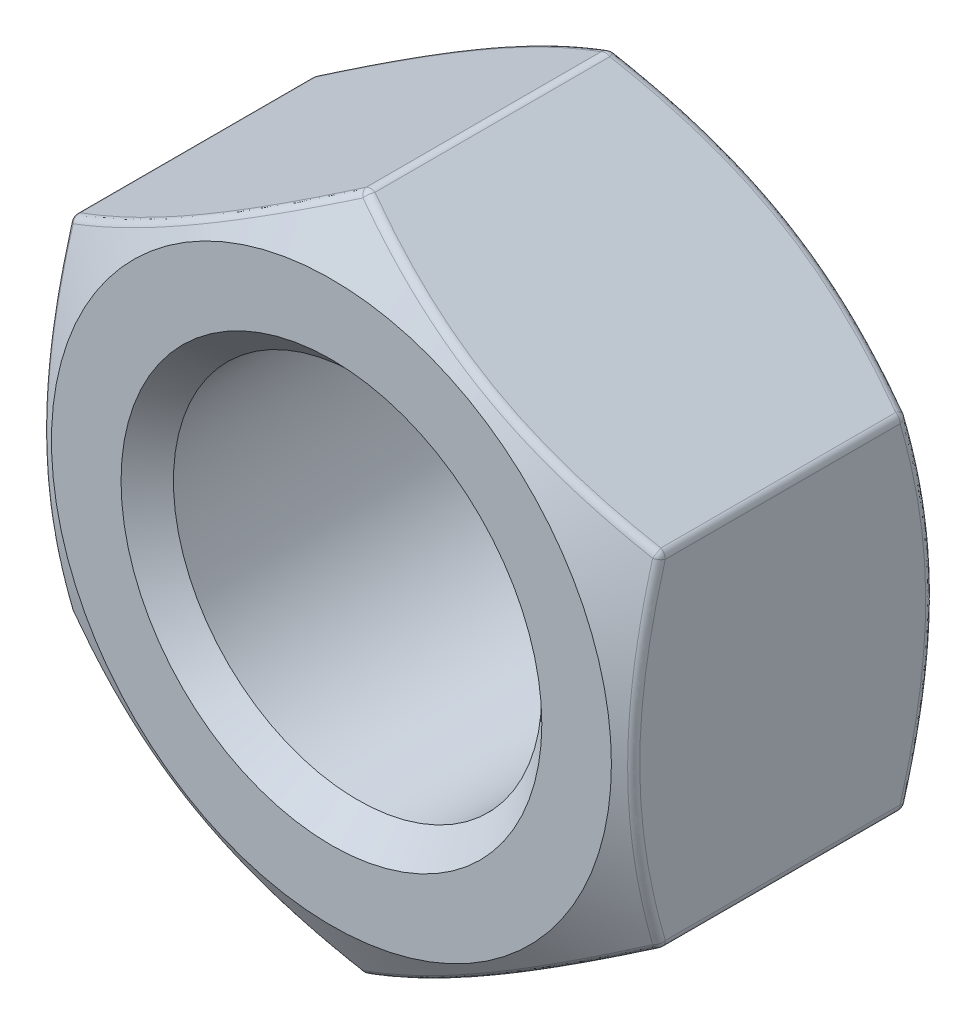
from build123d import *

# Parameters (mm, degrees)
SKETCH3_R           = 3.96875
BOSS_EXTRUDE1_DEPTH = 3.3734375
SKETCH4_OUTSIDE_W   = 63.202
SKETCH4_OUTSIDE_H   = 65.166
SKETCH4_OUTSIDE_R   = 6.0325
CUT_EXTRUDE1_DEPTH  = 12.815504881
CUT_EXTRUDE1_DRAFT  = -60
CUT_EXTRUDE2_START  = -6.746875
SKETCH4_2_OUTSIDE_W = 86.574
SKETCH4_2_OUTSIDE_H = 88.538
SKETCH4_2_OUTSIDE_R = 6.0325
CUT_EXTRUDE2_DEPTH  = 19.562379881
CUT_EXTRUDE2_DRAFT  = 60
FILLET1_R           = 0.1905
CHAMFER1_SIZE       = 0.564444444


with BuildPart() as part:
    # Sketch3 → Boss-Extrude1 (new, symmetric)
    with BuildSketch(Plane.XY):
        Polygon((0, 7.332348419), (-6.35, 3.666174209), (-6.35, -3.666174209), (0, -7.332348419), (6.35, -3.666174209), (6.35, 3.666174209), align=None)
        Circle(SKETCH3_R, mode=Mode.SUBTRACT)
    extrude(amount=BOSS_EXTRUDE1_DEPTH, both=True)


with BuildPart() as cut_extrude1_tool:
    # Sketch4 outside → Cut-Extrude1 (with draft: the straight prism first)
    with BuildSketch(Plane.XY.offset(3.3734375)):
        Rectangle(SKETCH4_OUTSIDE_W, SKETCH4_OUTSIDE_H)
        Circle(SKETCH4_OUTSIDE_R, mode=Mode.SUBTRACT)
    extrude(amount=-CUT_EXTRUDE1_DEPTH)
    # Cut-Extrude1: the draft: its side faces are tilted about the plane it starts from
    cut_extrude1_sides = [cut_extrude1_tool.faces().sort_by_distance(p)[0] for p in [
        (0, -32.583, -3.034314941),
        (31.601, 0, -3.034314941),
        (0, 32.583, -3.034314941),
        (-31.601, 0, -3.034314941),
        (-6.0325, 0, -3.034314941),
    ]]
    draft(cut_extrude1_sides, Plane.XY.offset(3.3734375), CUT_EXTRUDE1_DRAFT)


with BuildPart() as part_1:
    add(part.part)

    # Cut-Extrude1: cut by cut_extrude1_tool
    add(cut_extrude1_tool.part, mode=Mode.SUBTRACT)


with BuildPart() as cut_extrude2_tool:
    # Sketch4<2> outside → Cut-Extrude2 (with draft: the straight prism first)
    with BuildSketch(Plane.XY.offset(3.3734375).offset(CUT_EXTRUDE2_START)):
        Rectangle(SKETCH4_2_OUTSIDE_W, SKETCH4_2_OUTSIDE_H)
        Circle(SKETCH4_2_OUTSIDE_R, mode=Mode.SUBTRACT)
    extrude(amount=CUT_EXTRUDE2_DEPTH)
    # Cut-Extrude2: the draft: its side faces are tilted about the plane it starts from
    cut_extrude2_sides = [cut_extrude2_tool.faces().sort_by_distance(p)[0] for p in [
        (0, -44.269, 6.407752441),
        (43.287, 0, 6.407752441),
        (0, 44.269, 6.407752441),
        (-43.287, 0, 6.407752441),
        (-6.0325, 0, 6.407752441),
    ]]
    draft(cut_extrude2_sides, Plane.XY.offset(3.3734375).offset(CUT_EXTRUDE2_START), CUT_EXTRUDE2_DRAFT)


with BuildPart() as part_2:
    add(part_1.part)

    # Cut-Extrude2: cut by cut_extrude2_tool
    add(cut_extrude2_tool.part, mode=Mode.SUBTRACT)

    # Fillet1
    fillet1_edges = [part_2.edges().sort_by_distance(p)[0] for p in [
        (6.35, 3.666174209, 0),
        (6.35, -3.666174209, 0),
        (6.35, -1.852859506, 3.037246032),
        (0, -7.332348419, 0),
        (-6.35, -3.666174209, 0),
        (-6.35, 3.666174209, 0),
        (0, 7.332348419, 0),
        (3.175, 5.499261314, 3.19012879),
        (-3.175, 5.499261314, 3.19012879),
        (-6.35, 0, 3.19012879),
        (-3.175, -5.499261314, 3.19012879),
        (3.175, -5.499261314, 3.19012879),
        (6.35, -1.852859506, -3.037246032),
        (3.175, 5.499261314, -3.19012879),
        (-3.175, 5.499261314, -3.19012879),
        (-6.35, 0, -3.19012879),
        (-3.175, -5.499261314, -3.19012879),
        (3.175, -5.499261314, -3.19012879),
    ]]
    fillet(fillet1_edges, radius=FILLET1_R)

    # Chamfer1
    chamfer1_edges = [part_2.edges().sort_by_distance(p)[0] for p in [
        (-3.96875, 0, -3.3734375),
        (-3.96875, 0, 3.3734375),
    ]]
    chamfer(chamfer1_edges, length=CHAMFER1_SIZE)


solid = part_2.part
